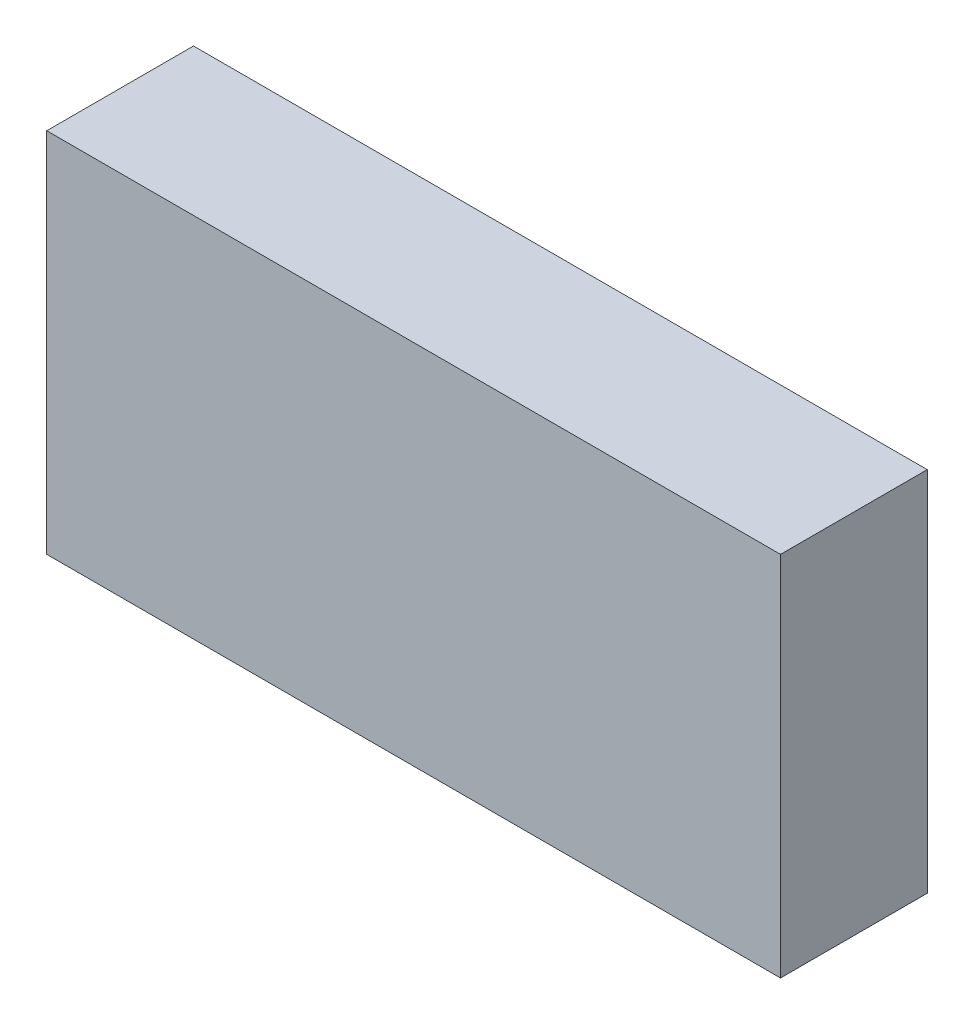
from build123d import *

# Parameters (mm, degrees)
SKETCH_1_W      = 50
SKETCH_1_H      = 25
EXTRUDE_1_DEPTH = 10


with BuildPart() as part:
    # 草图1 → 凸台-拉伸1 (new body)
    with BuildSketch(Plane.XY):
        Rectangle(SKETCH_1_W, SKETCH_1_H)
    extrude(amount=EXTRUDE_1_DEPTH)


solid = part.part
